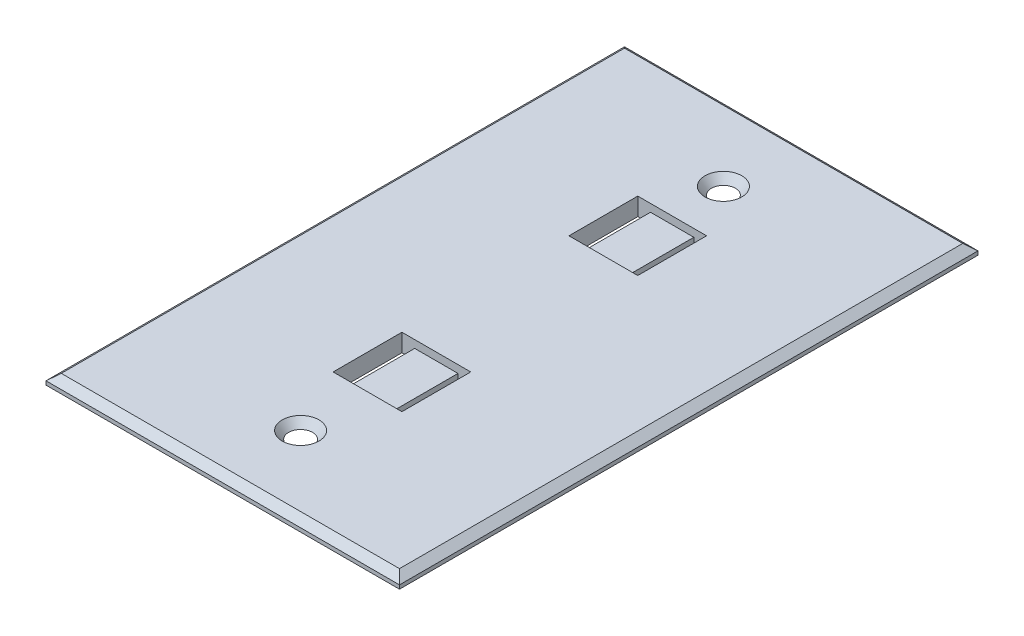
from build123d import *
from OCP.BRepFilletAPI import BRepFilletAPI_MakeChamfer

# Parameters (mm, degrees)
SKETCH1_W           = 69.35
SKETCH1_H           = 113.5
BOSS_EXTRUDE5_DEPTH = 2
SKETCH2_R           = 2.35
CUT_EXTRUDE3_DEPTH  = 2.5
FACE_CHAMFER_SIZE   = 1.5
FACE_CHAMFER_SIZE2  = 1.258649447
SKETCH4_W           = 60.238416088
SKETCH4_H           = 90.514495008
CUT_EXTRUDE6_DEPTH  = 0.5
SKETCH7_W           = 32.053406032
SKETCH7_H           = 66.80437594
BOSS_EXTRUDE6_DEPTH = 2
SKETCH8_W           = 13.5
SKETCH8_H           = 13.5
CUT_EXTRUDE14_DEPTH = 1.5
SKETCH16_W          = 2.5
SKETCH16_H          = 13.5
CUT_EXTRUDE15_DEPTH = 3.5
SKETCH17_W          = 2.5
SKETCH17_H          = 13.5
CUT_EXTRUDE16_DEPTH = 3.5
SKETCH18_W          = 13.5
SKETCH18_H          = 13.5
CUT_EXTRUDE17_DEPTH = 1.5
SKETCH19_W          = 2.5
SKETCH19_H          = 13.5
CUT_EXTRUDE18_DEPTH = 2.5
SKETCH20_W          = 2.5
SKETCH20_H          = 13.5
CUT_EXTRUDE19_DEPTH = 2.5


with BuildPart() as part:
    # Sketch1 → Boss-Extrude5 (new body)
    with BuildSketch(Plane(origin=(0, 0, 0), x_dir=(1, 0, 0), z_dir=(0, 1, 0))):
        Rectangle(SKETCH1_W, SKETCH1_H)
    extrude(amount=BOSS_EXTRUDE5_DEPTH)

    # Sketch2 → Cut-Extrude3 (cut)
    with BuildSketch(Plane(origin=(0, 2, 0), x_dir=(1, 0, 0), z_dir=(0, 1, 0))):
        with Locations(Location((0, 41.476002696, 0), (0, 0, 270))):
            Circle(SKETCH2_R)
        with Locations(Location((0, -41.476002696, 0), (0, 0, 90))):
            Circle(SKETCH2_R)
    extrude(amount=-CUT_EXTRUDE3_DEPTH, mode=Mode.SUBTRACT)

    # face chamfer: one chamfer whose edges measure the first distance from different faces: ONE call of the kernel's chamfer builder (chamfer() names one face for all edges)
    face_chamfer_edges_1 = [part.edges().sort_by_distance(p)[0] for p in [
        (0, 2, -56.75),
        (-34.675, 2, 0),
        (0, 2, 56.75),
        (34.675, 2, 0),
    ]]
    face_chamfer_side_1 = [part.faces().sort_by_distance(p)[0] for p in [
        (0, 2, 0),
    ]]
    face_chamfer_edges_2 = [part.edges().sort_by_distance(p)[0] for p in [
        (0, 2, -43.826002696),
    ]]
    face_chamfer_side_2 = [part.faces().sort_by_distance(p)[0] for p in [
        (0, 1, -43.826002696),
    ]]
    face_chamfer_edges_3 = [part.edges().sort_by_distance(p)[0] for p in [
        (0, 2, 43.826002696),
    ]]
    face_chamfer_side_3 = [part.faces().sort_by_distance(p)[0] for p in [
        (0, 1, 43.826002696),
    ]]
    face_chamfer = BRepFilletAPI_MakeChamfer(part.part.solid().wrapped)
    for e in face_chamfer_edges_1:
        face_chamfer.Add(FACE_CHAMFER_SIZE, FACE_CHAMFER_SIZE2, e.wrapped, face_chamfer_side_1[0].wrapped)  # the first distance lies on this face
    for e in face_chamfer_edges_2:
        face_chamfer.Add(FACE_CHAMFER_SIZE, FACE_CHAMFER_SIZE2, e.wrapped, face_chamfer_side_2[0].wrapped)  # the first distance lies on this face
    for e in face_chamfer_edges_3:
        face_chamfer.Add(FACE_CHAMFER_SIZE, FACE_CHAMFER_SIZE2, e.wrapped, face_chamfer_side_3[0].wrapped)  # the first distance lies on this face
    add(Compound.cast(face_chamfer.Shape()), mode=Mode.REPLACE)

    # Sketch4 → Cut-Extrude6 (cut)
    with BuildSketch(Plane(origin=(0, 0, 0), x_dir=(-1, 0, 0), z_dir=(0, -1, 0))):
        Rectangle(SKETCH4_W, SKETCH4_H)
    extrude(amount=-CUT_EXTRUDE6_DEPTH, mode=Mode.SUBTRACT)

    # Sketch7 → Boss-Extrude6 (add)
    with BuildSketch(Plane(origin=(0, 0.5, 0), x_dir=(-1, 0, 0), z_dir=(0, -1, 0))):
        Rectangle(SKETCH7_W, SKETCH7_H)
    extrude(amount=BOSS_EXTRUDE6_DEPTH)

    # Sketch8 → Cut-Extrude14 (cut)
    with BuildSketch(Plane(origin=(0, 2, 0), x_dir=(1, 0, 0), z_dir=(0, 1, 0))):
        with Locations((0, 24.674775436)):
            Rectangle(SKETCH8_W, SKETCH8_H)
    extrude(amount=-CUT_EXTRUDE14_DEPTH, mode=Mode.SUBTRACT)

    # Sketch16 → Cut-Extrude15 (cut)
    with BuildSketch(Plane(origin=(0, 0.5, 0), x_dir=(1, 0, 0), z_dir=(0, 1, 0))):
        with Locations((-5.5, 24.674775436)):
            Rectangle(SKETCH16_W, SKETCH16_H)
    extrude(amount=-CUT_EXTRUDE15_DEPTH, mode=Mode.SUBTRACT)

    # Sketch17 → Cut-Extrude16 (cut)
    with BuildSketch(Plane(origin=(0, 0.5, 0), x_dir=(1, 0, 0), z_dir=(0, 1, 0))):
        with Locations((5.5, 24.674775436)):
            Rectangle(SKETCH17_W, SKETCH17_H)
    extrude(amount=-CUT_EXTRUDE16_DEPTH, mode=Mode.SUBTRACT)

    # Sketch18 → Cut-Extrude17 (cut)
    with BuildSketch(Plane(origin=(0, 2, 0), x_dir=(1, 0, 0), z_dir=(0, 1, 0))):
        with Locations((0, -21.592367817)):
            Rectangle(SKETCH18_W, SKETCH18_H)
    extrude(amount=-CUT_EXTRUDE17_DEPTH, mode=Mode.SUBTRACT)

    # Sketch19 → Cut-Extrude18 (cut)
    with BuildSketch(Plane(origin=(0, 0.5, 0), x_dir=(1, 0, 0), z_dir=(0, 1, 0))):
        with Locations((-5.5, -21.592367817)):
            Rectangle(SKETCH19_W, SKETCH19_H)
    extrude(amount=-CUT_EXTRUDE18_DEPTH, mode=Mode.SUBTRACT)

    # Sketch20 → Cut-Extrude19 (cut)
    with BuildSketch(Plane(origin=(0, 0.5, 0), x_dir=(1, 0, 0), z_dir=(0, 1, 0))):
        with Locations((5.5, -21.592367817)):
            Rectangle(SKETCH20_W, SKETCH20_H)
    extrude(amount=-CUT_EXTRUDE19_DEPTH, mode=Mode.SUBTRACT)


solid = part.part
